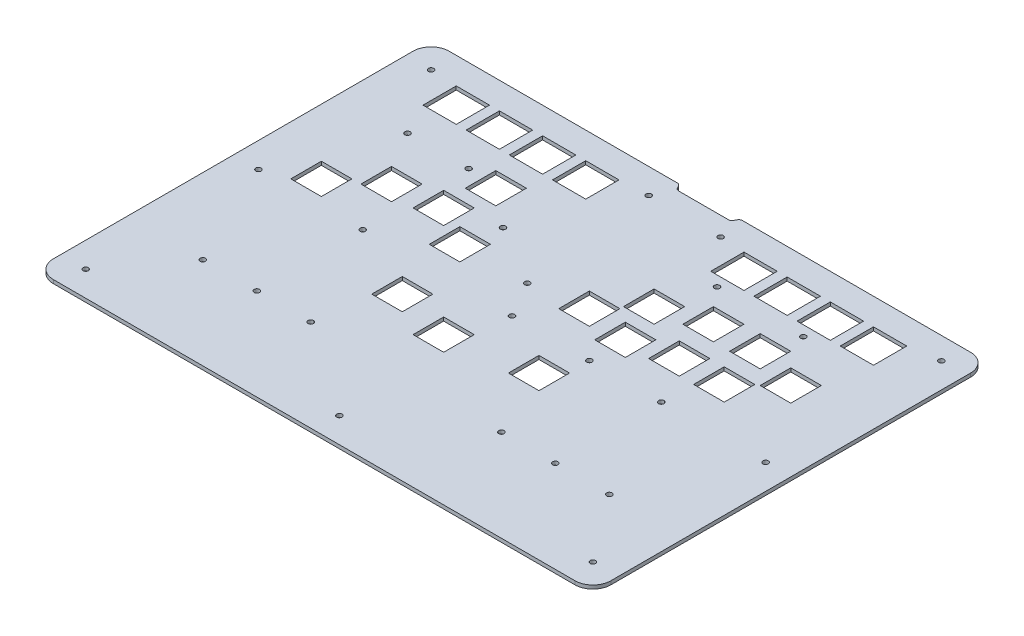
from build123d import *

# Parameters (mm, degrees)
SKETCH_1_R      = 1.5
SKETCH_1_W      = 18.5
SKETCH_1_H      = 18.5
SKETCH_1_W_2    = 17
SKETCH_1_H_2    = 17
EXTRUDE_1_DEPTH = 2


with BuildPart() as part:
    # 草图1 → 凸台-拉伸1 (new body)
    with BuildSketch(Plane(origin=(0, 0, 0), x_dir=(1, 0, 0), z_dir=(0, 1, 0))):
        with BuildLine():
            Line((10, 0), (136.884360712, 0))
            ThreePointArc((136.884360712, 0), (137.900113715, -0.277140216), (138.634360712, -1.031754163))
            Line((138.634360712, -1.031754163), (139.429147615, -2.468245837))
            ThreePointArc((139.429147615, -2.468245837), (140.163394612, -3.222859784), (141.179147615, -3.5))
            Line((141.179147615, -3.5), (143.5, -3.5))
            Line((143.5, -3.5), (166.5, -3.5))
            Line((166.5, -3.5), (168.820852385, -3.5))
            ThreePointArc((168.820852385, -3.5), (169.836605388, -3.222859784), (170.570852385, -2.468245837))
            Line((170.570852385, -2.468245837), (171.365639288, -1.031754163))
            ThreePointArc((171.365639288, -1.031754163), (172.099886285, -0.277140216), (173.115639288, 0))
            Line((173.115639288, 0), (300, 0))
            ThreePointArc((300, 0), (307.071067812, -2.928932188), (310, -10))
            Line((310, -10), (310, -210))
            ThreePointArc((310, -210), (307.071067812, -217.071067812), (300, -220))
            Line((300, -220), (10, -220))
            ThreePointArc((10, -220), (2.928932188, -217.071067812), (0, -210))
            Line((0, -210), (0, -10))
            ThreePointArc((0, -10), (2.928932188, -2.928932188), (10, 0))
        make_face()
        with Locations(Location((14, -14, 0), (0, 0, 270))):
            Circle(SKETCH_1_R, mode=Mode.SUBTRACT)
        with Locations(Location((14, -206, 0), (0, 0, 270))):
            Circle(SKETCH_1_R, mode=Mode.SUBTRACT)
        with Locations(Location((296, -206, 0), (0, 0, 270))):
            Circle(SKETCH_1_R, mode=Mode.SUBTRACT)
        with Locations(Location((296, -12.28568254, 0), (0, 0, 270))):
            Circle(SKETCH_1_R, mode=Mode.SUBTRACT)
        with Locations(Location((155, -206, 0), (0, 0, 270))):
            Circle(SKETCH_1_R, mode=Mode.SUBTRACT)
        with Locations(Location((175, -14, 0), (0, 0, 270))):
            Circle(SKETCH_1_R, mode=Mode.SUBTRACT)
        with Locations(Location((135, -14, 0), (0, 0, 270))):
            Circle(SKETCH_1_R, mode=Mode.SUBTRACT)
        with Locations(Location((296, -110, 0), (0, 0, 270))):
            Circle(SKETCH_1_R, mode=Mode.SUBTRACT)
        with Locations(Location((14, -110, 0), (0, 0, 270))):
            Circle(SKETCH_1_R, mode=Mode.SUBTRACT)
        with Locations(Location((155, -110, 0), (0, 0, 270))):
            Circle(SKETCH_1_R, mode=Mode.SUBTRACT)
        with Locations(Location((72, -110, 0), (0, 0, 270))):
            Circle(SKETCH_1_R, mode=Mode.SUBTRACT)
        with Locations(Location((72, -168.903225806, 0), (0, 0, 270))):
            Circle(SKETCH_1_R, mode=Mode.SUBTRACT)
        with Locations(Location((72, -51.096774194, 0), (0, 0, 270))):
            Circle(SKETCH_1_R, mode=Mode.SUBTRACT)
        with Locations(Location((42, -168.903225806, 0), (0, 0, 270))):
            Circle(SKETCH_1_R, mode=Mode.SUBTRACT)
        with Locations(Location((102, -168.903225806, 0), (0, 0, 270))):
            Circle(SKETCH_1_R, mode=Mode.SUBTRACT)
        with Locations(Location((238, -110, 0), (0, 0, 270))):
            Circle(SKETCH_1_R, mode=Mode.SUBTRACT)
        with Locations(Location((238, -168.903225806, 0), (0, 0, 270))):
            Circle(SKETCH_1_R, mode=Mode.SUBTRACT)
        with Locations(Location((268, -168.903225806, 0), (0, 0, 270))):
            Circle(SKETCH_1_R, mode=Mode.SUBTRACT)
        with Locations(Location((208, -168.903225806, 0), (0, 0, 270))):
            Circle(SKETCH_1_R, mode=Mode.SUBTRACT)
        with Locations(Location((246, -39, 0), (0, 0, 270))):
            Circle(SKETCH_1_R, mode=Mode.SUBTRACT)
        with Locations(Location((198, -39, 0), (0, 0, 270))):
            Circle(SKETCH_1_R, mode=Mode.SUBTRACT)
        with Locations(Location((110, -70, 0), (0, 0, 270))):
            Circle(SKETCH_1_R, mode=Mode.SUBTRACT)
        with Locations(Location((38, -51.096774194, 0), (0, 0, 270))):
            Circle(SKETCH_1_R, mode=Mode.SUBTRACT)
        with Locations(Location((198, -110, 0), (0, 0, 270))):
            Circle(SKETCH_1_R, mode=Mode.SUBTRACT)
        with Locations(Location((143.5, -90, 0), (0, 0, 270))):
            Circle(SKETCH_1_R, mode=Mode.SUBTRACT)
        with Locations((38, -24)):
            Rectangle(SKETCH_1_W, SKETCH_1_H, mode=Mode.SUBTRACT)
        with Locations((62, -24)):
            Rectangle(SKETCH_1_W, SKETCH_1_H, mode=Mode.SUBTRACT)
        with Locations((86, -24)):
            Rectangle(SKETCH_1_W, SKETCH_1_H, mode=Mode.SUBTRACT)
        with Locations((110, -24)):
            Rectangle(SKETCH_1_W, SKETCH_1_H, mode=Mode.SUBTRACT)
        with Locations((198, -24)):
            Rectangle(SKETCH_1_W, SKETCH_1_H, mode=Mode.SUBTRACT)
        with Locations((222, -24)):
            Rectangle(SKETCH_1_W, SKETCH_1_H, mode=Mode.SUBTRACT)
        with Locations((246, -24)):
            Rectangle(SKETCH_1_W, SKETCH_1_H, mode=Mode.SUBTRACT)
        with Locations((270, -24)):
            Rectangle(SKETCH_1_W, SKETCH_1_H, mode=Mode.SUBTRACT)
        with Locations((89, -53)):
            Rectangle(SKETCH_1_W_2, SKETCH_1_H_2, mode=Mode.SUBTRACT)
        with Locations((84, -77)):
            Rectangle(SKETCH_1_W_2, SKETCH_1_H_2, mode=Mode.SUBTRACT)
        with Locations((106, -90)):
            Rectangle(SKETCH_1_W_2, SKETCH_1_H_2, mode=Mode.SUBTRACT)
        with Locations((58, -80)):
            Rectangle(SKETCH_1_W_2, SKETCH_1_H_2, mode=Mode.SUBTRACT)
        with Locations((36, -97)):
            Rectangle(SKETCH_1_W_2, SKETCH_1_H_2, mode=Mode.SUBTRACT)
        with Locations((114, -130)):
            Rectangle(SKETCH_1_W_2, SKETCH_1_H_2, mode=Mode.SUBTRACT)
        with Locations((145, -138)):
            Rectangle(SKETCH_1_W_2, SKETCH_1_H_2, mode=Mode.SUBTRACT)
        with Locations((190, -130)):
            Rectangle(SKETCH_1_W_2, SKETCH_1_H_2, mode=Mode.SUBTRACT)
        with Locations((173, -85)):
            Rectangle(SKETCH_1_W_2, SKETCH_1_H_2, mode=Mode.SUBTRACT)
        with Locations((190, -66)):
            Rectangle(SKETCH_1_W_2, SKETCH_1_H_2, mode=Mode.SUBTRACT)
        with Locations((198, -90)):
            Rectangle(SKETCH_1_W_2, SKETCH_1_H_2, mode=Mode.SUBTRACT)
        with Locations((215, -58)):
            Rectangle(SKETCH_1_W_2, SKETCH_1_H_2, mode=Mode.SUBTRACT)
        with Locations((222, -84)):
            Rectangle(SKETCH_1_W_2, SKETCH_1_H_2, mode=Mode.SUBTRACT)
        with Locations((241, -58)):
            Rectangle(SKETCH_1_W_2, SKETCH_1_H_2, mode=Mode.SUBTRACT)
        with Locations((247, -84)):
            Rectangle(SKETCH_1_W_2, SKETCH_1_H_2, mode=Mode.SUBTRACT)
        with Locations((266, -66)):
            Rectangle(SKETCH_1_W_2, SKETCH_1_H_2, mode=Mode.SUBTRACT)
    extrude(amount=EXTRUDE_1_DEPTH)


solid = part.part
